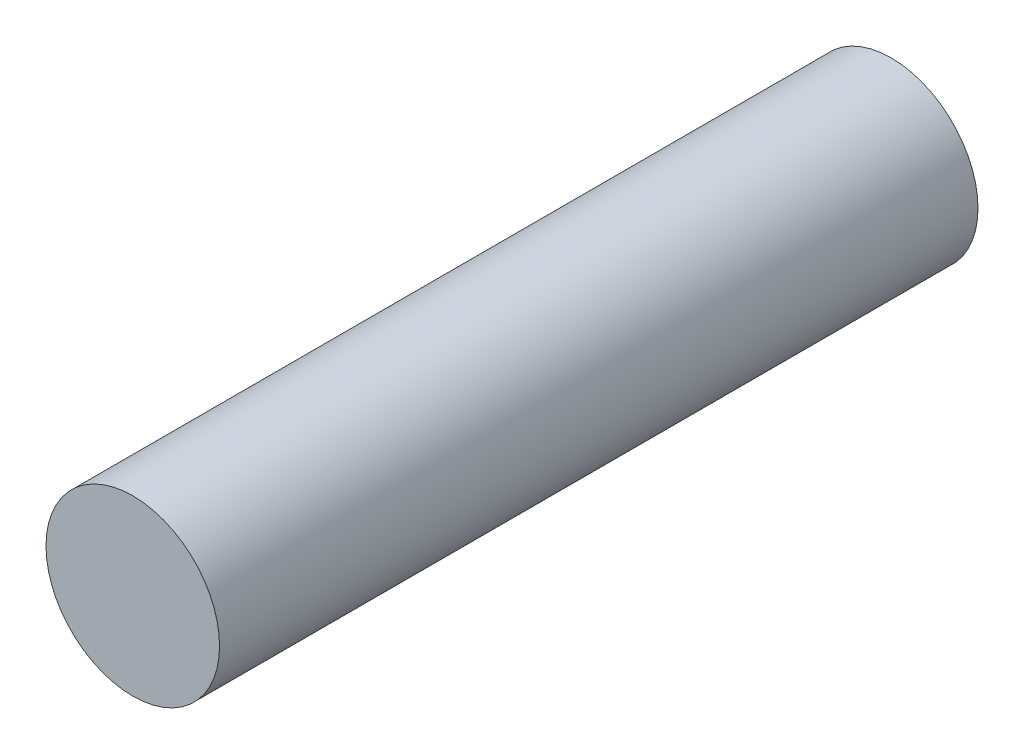
from build123d import *

# Parameters (mm, degrees)
ESQUISSE2_R        = 49.403
BOSS_EXTRU_1_DEPTH = 431.8


with BuildPart() as part:
    # Esquisse2 → Boss.-Extru.1 (new body)
    with BuildSketch(Plane.XY):
        Circle(ESQUISSE2_R)
    extrude(amount=BOSS_EXTRU_1_DEPTH)


solid = part.part
